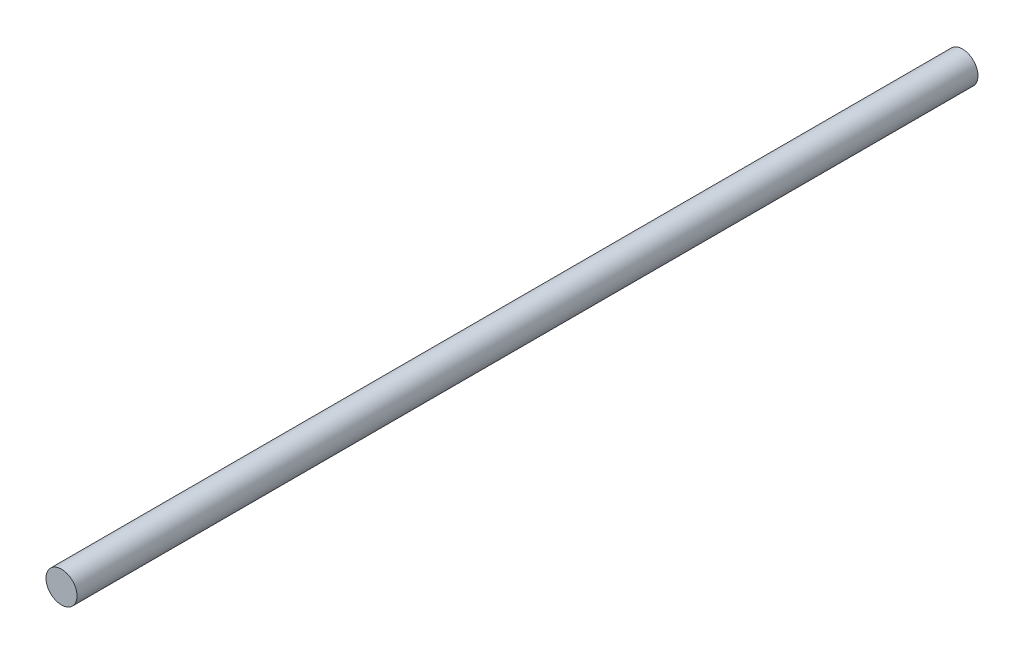
from build123d import *

# Parameters (mm, degrees)
SWEEP3_PROFILE_R = 10


with BuildPart() as part:
    # Sweep3: sweep along a path in Sketch4
    with BuildLine(Plane(origin=(0, 0, 0), x_dir=(0, 0, -1), z_dir=(1, 0, 0))) as sweep3_path:
        Line((177.787660408, 0), (-402.212339592, 0))
    # Sweep3 profile (on start of the path) → Sweep3 (sweep)
    with BuildSketch(Plane(origin=(0, 0, -177.787660408), x_dir=(0, 1, 0), z_dir=(0, 0, 1))):
        Circle(SWEEP3_PROFILE_R)
    sweep(path=sweep3_path.line)


solid = part.part
